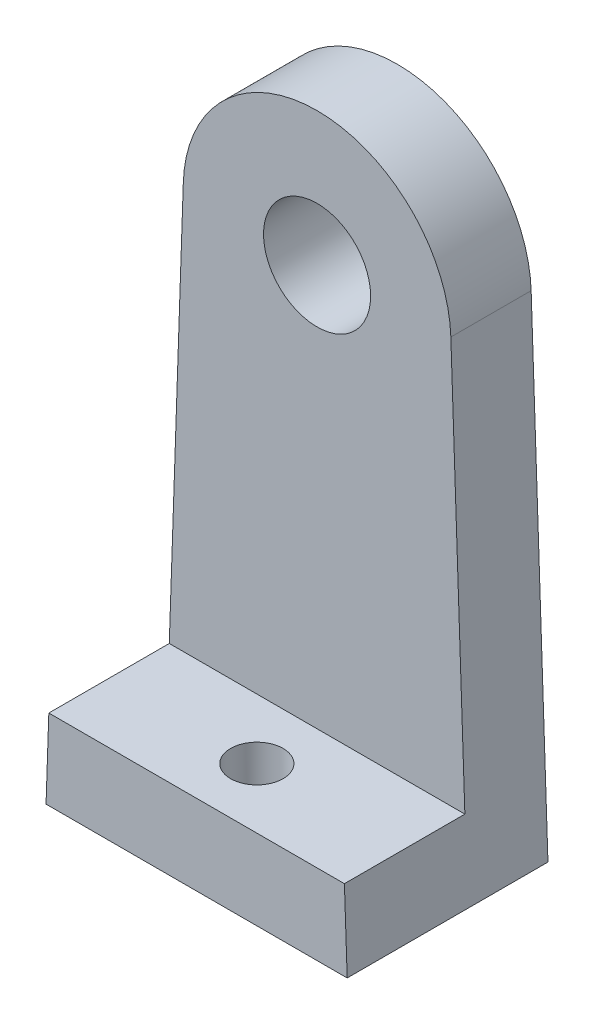
from build123d import *

# Parameters (mm, degrees)
BOSS_EXTRUDE1_DEPTH = 3.81
BOSS_EXTRUDE2_START = 3.81
BOSS_EXTRUDE2_DEPTH = 11.43
SKETCH3_R           = 5.08
CUT_EXTRUDE1_DEPTH  = 20
SKETCH4_R           = 2.4892
CUT_EXTRUDE2_DEPTH  = 20


with BuildPart() as part:
    # Sketch1 → Boss-Extrude1 (new, symmetric)
    with BuildSketch(Plane.XY):
        with BuildLine():
            Line((-14.2875, 0), (14.2875, 0))
            Line((14.2875, 0), (12.692423957, 46.158604709))
            ThreePointArc((12.692423957, 46.158604709), (0, 58.42), (-12.692423957, 46.158604709))
            Line((-12.692423957, 46.158604709), (-14.2875, 0))
        make_face()
    extrude(amount=BOSS_EXTRUDE1_DEPTH, both=True)

    # Sketch2 → Boss-Extrude2 (add)
    with BuildSketch(Plane.XY.offset(BOSS_EXTRUDE2_START)):
        Polygon((-14.2875, 0), (14.2875, 0), (14.024180094, 7.62), (-14.024180094, 7.62), align=None)
    extrude(amount=BOSS_EXTRUDE2_DEPTH)

    # Sketch3 → Cut-Extrude1 (cut, symmetric)
    with BuildSketch(Plane.XY):
        with Locations((0, 45.72)):
            Circle(SKETCH3_R)
    extrude(amount=CUT_EXTRUDE1_DEPTH, both=True, mode=Mode.SUBTRACT)

    # Sketch4 → Cut-Extrude2 (cut, symmetric)
    with BuildSketch(Plane(origin=(0, 0, 0), x_dir=(1, 0, 0), z_dir=(0, 1, 0))):
        with Locations(Location((0, -9.525, 0), (0, 0, 270))):
            Circle(SKETCH4_R)
    extrude(amount=CUT_EXTRUDE2_DEPTH, both=True, mode=Mode.SUBTRACT)


solid = part.part
